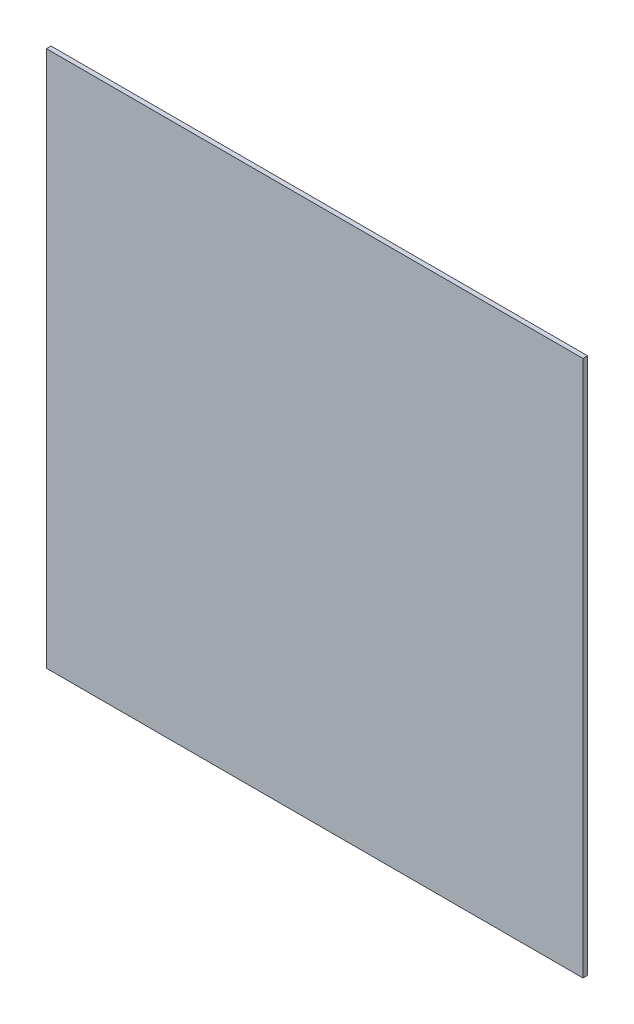
from build123d import *

# Parameters (mm, degrees)
SKETCH1_W           = 2900
SKETCH1_H           = 2900
BOSS_EXTRUDE1_DEPTH = 25


with BuildPart() as part:
    # Sketch1 → Boss-Extrude1 (new body)
    with BuildSketch(Plane.XY):
        Rectangle(SKETCH1_W, SKETCH1_H)
    extrude(amount=BOSS_EXTRUDE1_DEPTH)


solid = part.part
